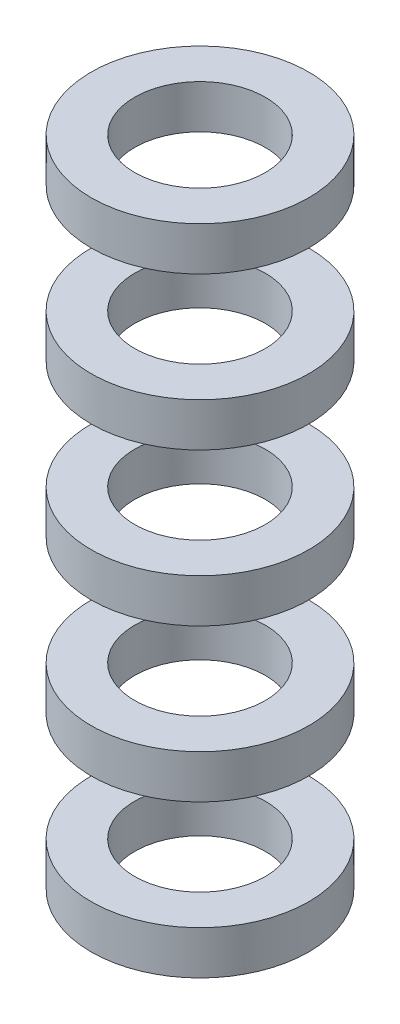
from build123d import *

# Parameters (mm, degrees)
SKETCH_1_R          = 50
SKETCH_1_R_2        = 30
EXTRUDE_1_DEPTH     = 300
SKETCH_2_W          = 100
SKETCH_2_H          = 50
CUT_EXTRUDE_1_DEPTH = 300


with BuildPart() as part:
    # 草图1 → 凸台-拉伸1 (new body)
    with BuildSketch(Plane(origin=(0, 0, 0), x_dir=(1, 0, 0), z_dir=(0, 1, 0))):
        with Locations(Location((0, 0, 0), (0, 0, 270))):
            Circle(SKETCH_1_R)
        with Locations(Location((0, 0, 0), (0, 0, 270))):
            Circle(SKETCH_1_R_2, mode=Mode.SUBTRACT)
    extrude(amount=EXTRUDE_1_DEPTH)

    # 草图2 → 切除-拉伸1 (cut)
    with BuildSketch(Plane.XY.offset(50)):
        with Locations((0, 255)):
            Rectangle(SKETCH_2_W, SKETCH_2_H)
        with Locations((0, 185)):
            Rectangle(SKETCH_2_W, SKETCH_2_H)
        with Locations((0, 115)):
            Rectangle(SKETCH_2_W, SKETCH_2_H)
        with Locations((0, 45)):
            Rectangle(SKETCH_2_W, SKETCH_2_H)
    extrude(amount=-CUT_EXTRUDE_1_DEPTH, mode=Mode.SUBTRACT)


with BuildPart() as cut_extrude_1_piece_1:
    # of the separate pieces the step leaves, piece 1, a body of its own (cut_extrude_1_pieces)
    add(part.part.solids().sort_by_distance((0, 280, 50))[0])


with BuildPart() as cut_extrude_1_piece_2:
    # of the separate pieces the step leaves, piece 2, a body of its own (cut_extrude_1_pieces)
    add(part.part.solids().sort_by_distance((0, 70, 50))[0])


with BuildPart() as cut_extrude_1_piece_3:
    # of the separate pieces the step leaves, piece 3, a body of its own (cut_extrude_1_pieces)
    add(part.part.solids().sort_by_distance((0, 0, 50))[0])


with BuildPart() as cut_extrude_1_piece_4:
    # of the separate pieces the step leaves, piece 4, a body of its own (cut_extrude_1_pieces)
    add(part.part.solids().sort_by_distance((0, 140, 50))[0])


with BuildPart() as cut_extrude_1_piece_5:
    # of the separate pieces the step leaves, piece 5, a body of its own (cut_extrude_1_pieces)
    add(part.part.solids().sort_by_distance((0, 210, 50))[0])


solid = Compound([cut_extrude_1_piece_1.part, cut_extrude_1_piece_2.part, cut_extrude_1_piece_3.part, cut_extrude_1_piece_4.part, cut_extrude_1_piece_5.part])
